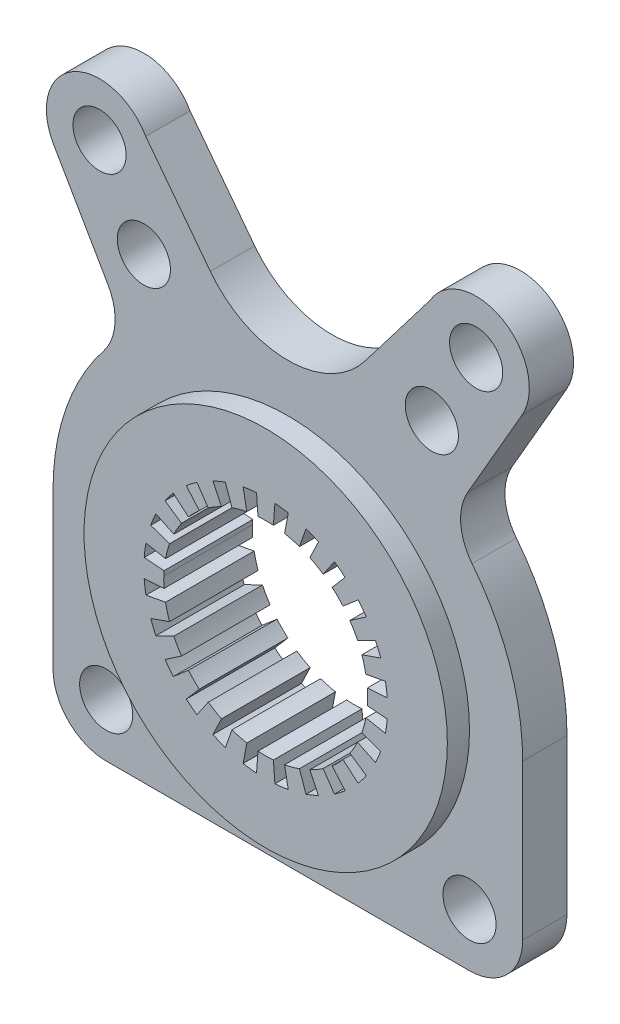
from build123d import *

# Parameters (mm, degrees)
SKETCH2_R           = 41
BOSS_EXTRUDE1_DEPTH = 5
SKETCH2_4_R         = 6
SKETCH2_4_R_2       = 41
BOSS_EXTRUDE2_DEPTH = 10
BOSS_EXTRUDE4_START = -15
SKETCH2_6_R         = 41
BOSS_EXTRUDE4_DEPTH = 15


with BuildPart() as part:
    # Sketch2 → Boss-Extrude1 (new body)
    with BuildSketch(Plane.XY):
        Circle(SKETCH2_R)
        with BuildLine():
            Line((-22.934326224, 1.736859422), (-27.421477007, 2.076679743))
            ThreePointArc((-27.421477007, 2.076679743), (-27.264707075, 3.589672426), (-27.024521608, 5.091682615))
            Line((-27.024521608, 5.091682615), (-22.602327163, 4.258498187))
            ThreePointArc((-22.602327163, 4.258498187), (-22.21624987, 5.953002748), (-21.703325711, 7.613517785))
            Line((-21.703325711, 7.613517785), (-25.949628568, 9.103119091))
            ThreePointArc((-25.949628568, 9.103119091), (-25.40660912, 10.523982754), (-24.785858932, 11.912648614))
            Line((-24.785858932, 11.912648614), (-20.729991107, 9.963306114))
            ThreePointArc((-20.729991107, 9.963306114), (-19.918499026, 11.500147675), (-18.993279418, 12.971327494))
            Line((-18.993279418, 12.971327494), (-22.709355826, 15.509195917))
            ThreePointArc((-22.709355826, 15.509195917), (-21.817092741, 16.741101049), (-20.85808093, 17.921787297))
            Line((-20.85808093, 17.921787297), (-17.444940414, 14.989131194))
            ThreePointArc((-17.444940414, 14.989131194), (-16.26333539, 16.263576543), (-14.98887252, 17.44516267))
            Line((-14.98887252, 17.44516267), (-17.921478013, 20.858346671))
            ThreePointArc((-17.921478013, 20.858346671), (-16.740777545, 21.817340974), (-15.508859182, 22.709585792))
            Line((-15.508859182, 22.709585792), (-12.971045862, 18.993471754))
            ThreePointArc((-12.971045862, 18.993471754), (-11.499852324, 19.918669547), (-9.96299873, 20.730138839))
            Line((-9.96299873, 20.730138839), (-11.91228109, 24.786035569))
            ThreePointArc((-11.91228109, 24.786035569), (-10.523606026, 25.406765166), (-9.102734311, 25.949763545))
            Line((-9.102734311, 25.949763545), (-7.613195969, 21.703438602))
            ThreePointArc((-7.613195969, 21.703438602), (-5.952673326, 22.216338138), (-4.258163041, 22.602390305))
            Line((-4.258163041, 22.602390305), (-5.091281897, 27.024597104))
            ThreePointArc((-5.091281897, 27.024597104), (-3.589268146, 27.264760299), (-2.07627314, 27.421507797))
            Line((-2.07627314, 27.421507797), (-1.736519353, 22.934351976))
            ThreePointArc((-1.736519353, 22.934351976), (0.000170521, 22.999999999), (1.736859422, 22.934326224))
            Line((1.736859422, 22.934326224), (2.076679743, 27.421477007))
            ThreePointArc((2.076679743, 27.421477007), (3.589672426, 27.264707075), (5.091682615, 27.024521608))
            Line((5.091682615, 27.024521608), (4.258498187, 22.602327163))
            ThreePointArc((4.258498187, 22.602327163), (5.953002748, 22.21624987), (7.613517785, 21.703325711))
            Line((7.613517785, 21.703325711), (9.103119091, 25.949628568))
            ThreePointArc((9.103119091, 25.949628568), (10.523982754, 25.40660912), (11.912648614, 24.785858932))
            Line((11.912648614, 24.785858932), (9.963306114, 20.729991107))
            ThreePointArc((9.963306114, 20.729991107), (11.500147675, 19.918499026), (12.971327494, 18.993279418))
            Line((12.971327494, 18.993279418), (15.509195917, 22.709355826))
            ThreePointArc((15.509195917, 22.709355826), (16.741101049, 21.817092741), (17.921787297, 20.85808093))
            Line((17.921787297, 20.85808093), (14.989131194, 17.444940414))
            ThreePointArc((14.989131194, 17.444940414), (16.263576543, 16.26333539), (17.44516267, 14.98887252))
            Line((17.44516267, 14.98887252), (20.858346671, 17.921478013))
            ThreePointArc((20.858346671, 17.921478013), (21.817340974, 16.740777545), (22.709585792, 15.508859182))
            Line((22.709585792, 15.508859182), (18.993471754, 12.971045862))
            ThreePointArc((18.993471754, 12.971045862), (19.918669547, 11.499852324), (20.730138839, 9.96299873))
            Line((20.730138839, 9.96299873), (24.786035569, 11.91228109))
            ThreePointArc((24.786035569, 11.91228109), (25.406765166, 10.523606026), (25.949763545, 9.102734311))
            Line((25.949763545, 9.102734311), (21.703438602, 7.613195969))
            ThreePointArc((21.703438602, 7.613195969), (22.216338138, 5.952673326), (22.602390305, 4.258163041))
            Line((22.602390305, 4.258163041), (27.024597104, 5.091281897))
            ThreePointArc((27.024597104, 5.091281897), (27.264760299, 3.589268146), (27.421507797, 2.07627314))
            Line((27.421507797, 2.07627314), (22.934351976, 1.736519353))
            ThreePointArc((22.934351976, 1.736519353), (22.999999999, -0.000170521), (22.934326224, -1.736859422))
            Line((22.934326224, -1.736859422), (27.421477007, -2.076679743))
            ThreePointArc((27.421477007, -2.076679743), (27.264707075, -3.589672426), (27.024521608, -5.091682615))
            Line((27.024521608, -5.091682615), (22.602327163, -4.258498187))
            ThreePointArc((22.602327163, -4.258498187), (22.21624987, -5.953002748), (21.703325711, -7.613517785))
            Line((21.703325711, -7.613517785), (25.949628568, -9.103119091))
            ThreePointArc((25.949628568, -9.103119091), (25.40660912, -10.523982754), (24.785858932, -11.912648614))
            Line((24.785858932, -11.912648614), (20.729991107, -9.963306114))
            ThreePointArc((20.729991107, -9.963306114), (19.918499026, -11.500147675), (18.993279418, -12.971327494))
            Line((18.993279418, -12.971327494), (22.709355826, -15.509195917))
            ThreePointArc((22.709355826, -15.509195917), (21.817092741, -16.741101049), (20.85808093, -17.921787297))
            Line((20.85808093, -17.921787297), (17.444940414, -14.989131194))
            ThreePointArc((17.444940414, -14.989131194), (16.26333539, -16.263576543), (14.98887252, -17.44516267))
            Line((14.98887252, -17.44516267), (17.921478013, -20.858346671))
            ThreePointArc((17.921478013, -20.858346671), (16.740777545, -21.817340974), (15.508859182, -22.709585792))
            Line((15.508859182, -22.709585792), (12.971045862, -18.993471754))
            ThreePointArc((12.971045862, -18.993471754), (11.499852324, -19.918669547), (9.96299873, -20.730138839))
            Line((9.96299873, -20.730138839), (11.91228109, -24.786035569))
            ThreePointArc((11.91228109, -24.786035569), (10.523606026, -25.406765166), (9.102734311, -25.949763545))
            Line((9.102734311, -25.949763545), (7.613195969, -21.703438602))
            ThreePointArc((7.613195969, -21.703438602), (5.952673326, -22.216338138), (4.258163041, -22.602390305))
            Line((4.258163041, -22.602390305), (5.091281897, -27.024597104))
            ThreePointArc((5.091281897, -27.024597104), (3.589268146, -27.264760299), (2.07627314, -27.421507797))
            Line((2.07627314, -27.421507797), (1.736519353, -22.934351976))
            ThreePointArc((1.736519353, -22.934351976), (-0.000170521, -22.999999999), (-1.736859422, -22.934326224))
            Line((-1.736859422, -22.934326224), (-2.076679743, -27.421477007))
            ThreePointArc((-2.076679743, -27.421477007), (-3.589672426, -27.264707075), (-5.091682615, -27.024521608))
            Line((-5.091682615, -27.024521608), (-4.258498187, -22.602327163))
            ThreePointArc((-4.258498187, -22.602327163), (-5.953002748, -22.21624987), (-7.613517785, -21.703325711))
            Line((-7.613517785, -21.703325711), (-9.103119091, -25.949628568))
            ThreePointArc((-9.103119091, -25.949628568), (-10.523982754, -25.40660912), (-11.912648614, -24.785858932))
            Line((-11.912648614, -24.785858932), (-9.963306114, -20.729991107))
            ThreePointArc((-9.963306114, -20.729991107), (-11.500147675, -19.918499026), (-12.971327494, -18.993279418))
            Line((-12.971327494, -18.993279418), (-15.509195917, -22.709355826))
            ThreePointArc((-15.509195917, -22.709355826), (-16.741101049, -21.817092741), (-17.921787297, -20.85808093))
            Line((-17.921787297, -20.85808093), (-14.989131194, -17.444940414))
            ThreePointArc((-14.989131194, -17.444940414), (-16.263576543, -16.26333539), (-17.44516267, -14.98887252))
            Line((-17.44516267, -14.98887252), (-20.858346671, -17.921478013))
            ThreePointArc((-20.858346671, -17.921478013), (-21.817340974, -16.740777545), (-22.709585792, -15.508859182))
            Line((-22.709585792, -15.508859182), (-18.993471754, -12.971045862))
            ThreePointArc((-18.993471754, -12.971045862), (-19.918669547, -11.499852324), (-20.730138839, -9.96299873))
            Line((-20.730138839, -9.96299873), (-24.786035569, -11.91228109))
            ThreePointArc((-24.786035569, -11.91228109), (-25.406765166, -10.523606026), (-25.949763545, -9.102734311))
            Line((-25.949763545, -9.102734311), (-21.703438602, -7.613195969))
            ThreePointArc((-21.703438602, -7.613195969), (-22.216338138, -5.952673326), (-22.602390305, -4.258163041))
            Line((-22.602390305, -4.258163041), (-27.024597104, -5.091281897))
            ThreePointArc((-27.024597104, -5.091281897), (-27.264760299, -3.589268146), (-27.421507797, -2.07627314))
            Line((-27.421507797, -2.07627314), (-22.934351976, -1.736519353))
            ThreePointArc((-22.934351976, -1.736519353), (-23.009316331, -0.521515473), (-22.989477788, 0.695637153))
            ThreePointArc((-22.989477788, 0.695637153), (-22.96780311, 1.216560858), (-22.934326224, 1.736859422))
        make_face(mode=Mode.SUBTRACT)
    extrude(amount=BOSS_EXTRUDE1_DEPTH)



with BuildPart() as body_2:
    # Sketch2<4> → Boss-Extrude2 (new body)
    with BuildSketch(Plane.XY):
        with BuildLine():
            ThreePointArc((-41.574901147, 32.871379567), (-50.062309979, 17.400147115), (-53, 0))
            Line((-53, 0), (-53, -35))
            ThreePointArc((-53, -35), (-49.485281374, -43.485281374), (-41, -47))
            Line((-41, -47), (41, -47))
            ThreePointArc((41, -47), (49.485281374, -43.485281374), (53, -35))
            Line((53, -35), (53, 0))
            ThreePointArc((53, 0), (50.062309979, 17.400147115), (41.574901147, 32.871379567))
            ThreePointArc((41.574901147, 32.871379567), (39.019791763, 39.442218968), (40.595781466, 46.313956073))
            Line((40.595781466, 46.313956073), (52.892304845, 67.612159322))
            ThreePointArc((52.892304845, 67.612159322), (48.511069838, 83.998065127), (32.120505025, 79.634292172))
            Line((32.120505025, 79.634292172), (17.475289817, 60.455258008))
            ThreePointArc((17.475289817, 60.455258008), (-0.009862728, 51.807015963), (-17.495015273, 60.455258008))
            Line((-17.495015273, 60.455258008), (-32.06097715, 79.530503848))
            ThreePointArc((-32.06097715, 79.530503848), (-48.459218045, 84.027903188), (-52.892304845, 67.612159322))
            Line((-52.892304845, 67.612159322), (-40.595781466, 46.313956073))
            ThreePointArc((-40.595781466, 46.313956073), (-39.019791763, 39.442218968), (-41.574901147, 32.871379567))
        make_face()
        with Locations((-41, -35)):
            Circle(SKETCH2_4_R, mode=Mode.SUBTRACT)
        with Locations((41, -35)):
            Circle(SKETCH2_4_R, mode=Mode.SUBTRACT)
        Circle(SKETCH2_4_R_2, mode=Mode.SUBTRACT)
        with Locations((-32.5, 56.291651246)):
            Circle(SKETCH2_4_R, mode=Mode.SUBTRACT)
        with Locations((-42.5, 73.612159322)):
            Circle(SKETCH2_4_R, mode=Mode.SUBTRACT)
        with Locations((32.5, 56.291651246)):
            Circle(SKETCH2_4_R, mode=Mode.SUBTRACT)
        with Locations((42.5, 73.612159322)):
            Circle(SKETCH2_4_R, mode=Mode.SUBTRACT)
    extrude(amount=-BOSS_EXTRUDE2_DEPTH)


with BuildPart() as part_1:
    add(part.part)

    add(body_2.part)  # Boss-Extrude4 merges body 2
    # Sketch2<6> → Boss-Extrude4 (add)
    with BuildSketch(Plane.XY.offset(BOSS_EXTRUDE4_START)):
        Circle(SKETCH2_6_R)
        with BuildLine():
            Line((-22.934326224, 1.736859422), (-27.421477007, 2.076679743))
            ThreePointArc((-27.421477007, 2.076679743), (-27.264707075, 3.589672426), (-27.024521608, 5.091682615))
            Line((-27.024521608, 5.091682615), (-22.602327163, 4.258498187))
            ThreePointArc((-22.602327163, 4.258498187), (-22.21624987, 5.953002748), (-21.703325711, 7.613517785))
            Line((-21.703325711, 7.613517785), (-25.949628568, 9.103119091))
            ThreePointArc((-25.949628568, 9.103119091), (-25.40660912, 10.523982754), (-24.785858932, 11.912648614))
            Line((-24.785858932, 11.912648614), (-20.729991107, 9.963306114))
            ThreePointArc((-20.729991107, 9.963306114), (-19.918499026, 11.500147675), (-18.993279418, 12.971327494))
            Line((-18.993279418, 12.971327494), (-22.709355826, 15.509195917))
            ThreePointArc((-22.709355826, 15.509195917), (-21.817092741, 16.741101049), (-20.85808093, 17.921787297))
            Line((-20.85808093, 17.921787297), (-17.444940414, 14.989131194))
            ThreePointArc((-17.444940414, 14.989131194), (-16.26333539, 16.263576543), (-14.98887252, 17.44516267))
            Line((-14.98887252, 17.44516267), (-17.921478013, 20.858346671))
            ThreePointArc((-17.921478013, 20.858346671), (-16.740777545, 21.817340974), (-15.508859182, 22.709585792))
            Line((-15.508859182, 22.709585792), (-12.971045862, 18.993471754))
            ThreePointArc((-12.971045862, 18.993471754), (-11.499852324, 19.918669547), (-9.96299873, 20.730138839))
            Line((-9.96299873, 20.730138839), (-11.91228109, 24.786035569))
            ThreePointArc((-11.91228109, 24.786035569), (-10.523606026, 25.406765166), (-9.102734311, 25.949763545))
            Line((-9.102734311, 25.949763545), (-7.613195969, 21.703438602))
            ThreePointArc((-7.613195969, 21.703438602), (-5.952673326, 22.216338138), (-4.258163041, 22.602390305))
            Line((-4.258163041, 22.602390305), (-5.091281897, 27.024597104))
            ThreePointArc((-5.091281897, 27.024597104), (-3.589268146, 27.264760299), (-2.07627314, 27.421507797))
            Line((-2.07627314, 27.421507797), (-1.736519353, 22.934351976))
            ThreePointArc((-1.736519353, 22.934351976), (0.000170521, 22.999999999), (1.736859422, 22.934326224))
            Line((1.736859422, 22.934326224), (2.076679743, 27.421477007))
            ThreePointArc((2.076679743, 27.421477007), (3.589672426, 27.264707075), (5.091682615, 27.024521608))
            Line((5.091682615, 27.024521608), (4.258498187, 22.602327163))
            ThreePointArc((4.258498187, 22.602327163), (5.953002748, 22.21624987), (7.613517785, 21.703325711))
            Line((7.613517785, 21.703325711), (9.103119091, 25.949628568))
            ThreePointArc((9.103119091, 25.949628568), (10.523982754, 25.40660912), (11.912648614, 24.785858932))
            Line((11.912648614, 24.785858932), (9.963306114, 20.729991107))
            ThreePointArc((9.963306114, 20.729991107), (11.500147675, 19.918499026), (12.971327494, 18.993279418))
            Line((12.971327494, 18.993279418), (15.509195917, 22.709355826))
            ThreePointArc((15.509195917, 22.709355826), (16.741101049, 21.817092741), (17.921787297, 20.85808093))
            Line((17.921787297, 20.85808093), (14.989131194, 17.444940414))
            ThreePointArc((14.989131194, 17.444940414), (16.263576543, 16.26333539), (17.44516267, 14.98887252))
            Line((17.44516267, 14.98887252), (20.858346671, 17.921478013))
            ThreePointArc((20.858346671, 17.921478013), (21.817340974, 16.740777545), (22.709585792, 15.508859182))
            Line((22.709585792, 15.508859182), (18.993471754, 12.971045862))
            ThreePointArc((18.993471754, 12.971045862), (19.918669547, 11.499852324), (20.730138839, 9.96299873))
            Line((20.730138839, 9.96299873), (24.786035569, 11.91228109))
            ThreePointArc((24.786035569, 11.91228109), (25.406765166, 10.523606026), (25.949763545, 9.102734311))
            Line((25.949763545, 9.102734311), (21.703438602, 7.613195969))
            ThreePointArc((21.703438602, 7.613195969), (22.216338138, 5.952673326), (22.602390305, 4.258163041))
            Line((22.602390305, 4.258163041), (27.024597104, 5.091281897))
            ThreePointArc((27.024597104, 5.091281897), (27.264760299, 3.589268146), (27.421507797, 2.07627314))
            Line((27.421507797, 2.07627314), (22.934351976, 1.736519353))
            ThreePointArc((22.934351976, 1.736519353), (22.999999999, -0.000170521), (22.934326224, -1.736859422))
            Line((22.934326224, -1.736859422), (27.421477007, -2.076679743))
            ThreePointArc((27.421477007, -2.076679743), (27.264707075, -3.589672426), (27.024521608, -5.091682615))
            Line((27.024521608, -5.091682615), (22.602327163, -4.258498187))
            ThreePointArc((22.602327163, -4.258498187), (22.21624987, -5.953002748), (21.703325711, -7.613517785))
            Line((21.703325711, -7.613517785), (25.949628568, -9.103119091))
            ThreePointArc((25.949628568, -9.103119091), (25.40660912, -10.523982754), (24.785858932, -11.912648614))
            Line((24.785858932, -11.912648614), (20.729991107, -9.963306114))
            ThreePointArc((20.729991107, -9.963306114), (19.918499026, -11.500147675), (18.993279418, -12.971327494))
            Line((18.993279418, -12.971327494), (22.709355826, -15.509195917))
            ThreePointArc((22.709355826, -15.509195917), (21.817092741, -16.741101049), (20.85808093, -17.921787297))
            Line((20.85808093, -17.921787297), (17.444940414, -14.989131194))
            ThreePointArc((17.444940414, -14.989131194), (16.26333539, -16.263576543), (14.98887252, -17.44516267))
            Line((14.98887252, -17.44516267), (17.921478013, -20.858346671))
            ThreePointArc((17.921478013, -20.858346671), (16.740777545, -21.817340974), (15.508859182, -22.709585792))
            Line((15.508859182, -22.709585792), (12.971045862, -18.993471754))
            ThreePointArc((12.971045862, -18.993471754), (11.499852324, -19.918669547), (9.96299873, -20.730138839))
            Line((9.96299873, -20.730138839), (11.91228109, -24.786035569))
            ThreePointArc((11.91228109, -24.786035569), (10.523606026, -25.406765166), (9.102734311, -25.949763545))
            Line((9.102734311, -25.949763545), (7.613195969, -21.703438602))
            ThreePointArc((7.613195969, -21.703438602), (5.952673326, -22.216338138), (4.258163041, -22.602390305))
            Line((4.258163041, -22.602390305), (5.091281897, -27.024597104))
            ThreePointArc((5.091281897, -27.024597104), (3.589268146, -27.264760299), (2.07627314, -27.421507797))
            Line((2.07627314, -27.421507797), (1.736519353, -22.934351976))
            ThreePointArc((1.736519353, -22.934351976), (-0.000170521, -22.999999999), (-1.736859422, -22.934326224))
            Line((-1.736859422, -22.934326224), (-2.076679743, -27.421477007))
            ThreePointArc((-2.076679743, -27.421477007), (-3.589672426, -27.264707075), (-5.091682615, -27.024521608))
            Line((-5.091682615, -27.024521608), (-4.258498187, -22.602327163))
            ThreePointArc((-4.258498187, -22.602327163), (-5.953002748, -22.21624987), (-7.613517785, -21.703325711))
            Line((-7.613517785, -21.703325711), (-9.103119091, -25.949628568))
            ThreePointArc((-9.103119091, -25.949628568), (-10.523982754, -25.40660912), (-11.912648614, -24.785858932))
            Line((-11.912648614, -24.785858932), (-9.963306114, -20.729991107))
            ThreePointArc((-9.963306114, -20.729991107), (-11.500147675, -19.918499026), (-12.971327494, -18.993279418))
            Line((-12.971327494, -18.993279418), (-15.509195917, -22.709355826))
            ThreePointArc((-15.509195917, -22.709355826), (-16.741101049, -21.817092741), (-17.921787297, -20.85808093))
            Line((-17.921787297, -20.85808093), (-14.989131194, -17.444940414))
            ThreePointArc((-14.989131194, -17.444940414), (-16.263576543, -16.26333539), (-17.44516267, -14.98887252))
            Line((-17.44516267, -14.98887252), (-20.858346671, -17.921478013))
            ThreePointArc((-20.858346671, -17.921478013), (-21.817340974, -16.740777545), (-22.709585792, -15.508859182))
            Line((-22.709585792, -15.508859182), (-18.993471754, -12.971045862))
            ThreePointArc((-18.993471754, -12.971045862), (-19.918669547, -11.499852324), (-20.730138839, -9.96299873))
            Line((-20.730138839, -9.96299873), (-24.786035569, -11.91228109))
            ThreePointArc((-24.786035569, -11.91228109), (-25.406765166, -10.523606026), (-25.949763545, -9.102734311))
            Line((-25.949763545, -9.102734311), (-21.703438602, -7.613195969))
            ThreePointArc((-21.703438602, -7.613195969), (-22.216338138, -5.952673326), (-22.602390305, -4.258163041))
            Line((-22.602390305, -4.258163041), (-27.024597104, -5.091281897))
            ThreePointArc((-27.024597104, -5.091281897), (-27.264760299, -3.589268146), (-27.421507797, -2.07627314))
            Line((-27.421507797, -2.07627314), (-22.934351976, -1.736519353))
            ThreePointArc((-22.934351976, -1.736519353), (-23.009316331, -0.521515473), (-22.989477788, 0.695637153))
            ThreePointArc((-22.989477788, 0.695637153), (-22.96780311, 1.216560858), (-22.934326224, 1.736859422))
        make_face(mode=Mode.SUBTRACT)
    extrude(amount=BOSS_EXTRUDE4_DEPTH)


solid = part_1.part
